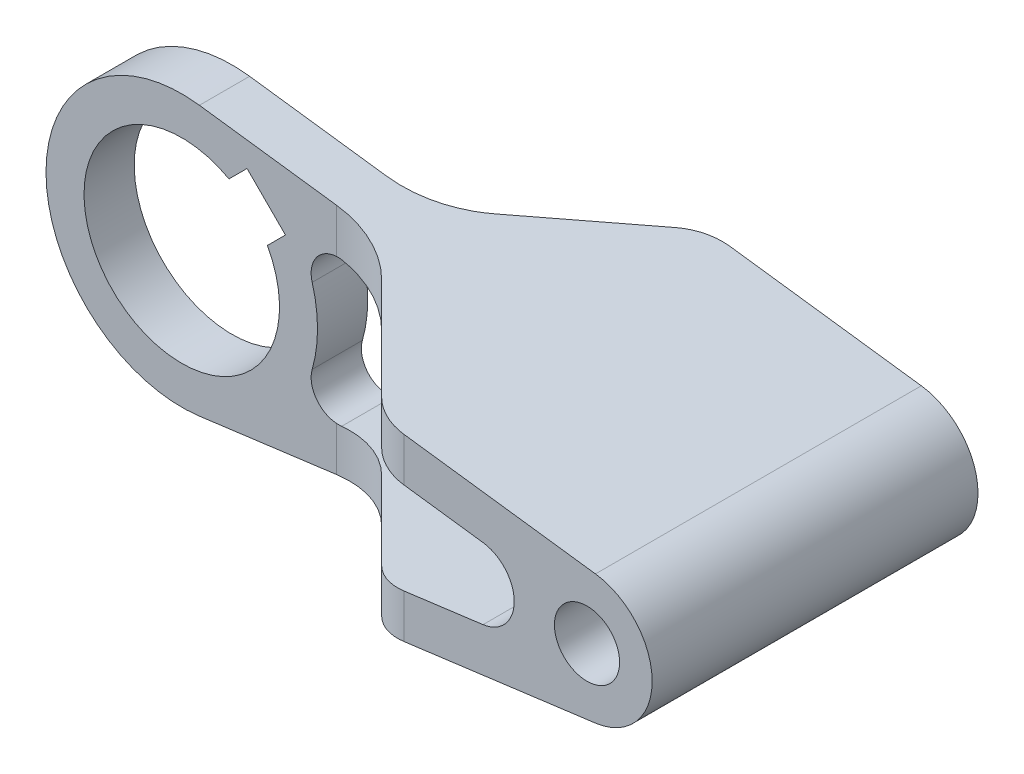
from build123d import *

# Parameters (mm, degrees)
SKETCH1_R           = 12
SKETCH1_R_2         = 6
BOSS_EXTRUDE1_DEPTH = 30
CUT_EXTRUDE1_DEPTH  = 30
FILLET1_R           = 10


with BuildPart() as part:
    # Sketch1 → Boss-Extrude1 (new, symmetric)
    # profile 1 of 2: a face of its own
    with BuildSketch(Plane.XY):
        with BuildLine():
            Line((44.05305559, 11.898167926), (-54.25694441, 24.787849846))
            ThreePointArc((-54.25694441, 24.787849846), (-82.50694441, 0), (-54.25694441, -24.787849846))
            Line((-54.25694441, -24.787849846), (44.05305559, -11.898167926))
            ThreePointArc((44.05305559, -11.898167926), (30.49305559, 0), (44.05305559, 11.898167926))
        make_face()
        with BuildLine():
            ThreePointArc((-33.488504763, 6.936465737), (-32.476597793, 11.582960804), (-28.034816833, 13.281328853))
            Line((-28.034816833, 13.281328853), (23.35105559, 6.543992359))
            ThreePointArc((23.35105559, 6.543992359), (29.09305559, 0), (23.35105559, -6.543992359))
            Line((23.35105559, -6.543992359), (-28.034816833, -13.281328853))
            ThreePointArc((-28.034816833, -13.281328853), (-32.476597793, -11.582960804), (-33.488504763, -6.936465737))
            ThreePointArc((-33.488504763, -6.936465737), (-32.50694441, 0), (-33.488504763, 6.936465737))
        make_face(mode=Mode.SUBTRACT)
        with BuildLine():
            ThreePointArc((-41.744391243, 8.691485355), (-70.234866471, -12.727922061), (-48.815459055, 15.762553167))
            Line((-48.815459055, 15.762553167), (-45.48612913, 19.091883092))
            Line((-45.48612913, 19.091883092), (-38.415061318, 12.02081528))
            Line((-38.415061318, 12.02081528), (-41.744391243, 8.691485355))
        make_face(mode=Mode.SUBTRACT)
    # profile 2 of 2: a face of its own
    with BuildSketch(Plane.XY):
        with Locations((42.49305559, 0)):
            Circle(SKETCH1_R)
        with Locations((42.49305559, 0)):
            Circle(SKETCH1_R_2, mode=Mode.SUBTRACT)
    extrude(amount=BOSS_EXTRUDE1_DEPTH, both=True)

    # Sketch5 → Cut-Extrude1 (cut, symmetric)
    with BuildSketch(Plane(origin=(0, 0, 0), x_dir=(1, 0, 0), z_dir=(0, 1, 0))):
        with BuildLine():
            ThreePointArc((-14.84129936, 10.479353549), (-21.329766336, 6.143898522), (-28.983434984, 4.621489173))
            Line((-28.983434984, 4.621489173), (-82.50694441, 4.621489173))
            Line((-82.50694441, 4.621489173), (-82.50694441, 30))
            Line((-82.50694441, 30), (4.679347091, 30))
            Line((4.679347091, 30), (-14.84129936, 10.479353549))
        make_face()
        with BuildLine():
            ThreePointArc((-28.983434984, -4.621489173), (-21.329766336, -6.143898522), (-14.84129936, -10.479353549))
            Line((-14.84129936, -10.479353549), (4.679347091, -30))
            Line((4.679347091, -30), (-82.50694441, -30))
            Line((-82.50694441, -30), (-82.50694441, -4.621489173))
            Line((-82.50694441, -4.621489173), (-28.983434984, -4.621489173))
        make_face()
    extrude(amount=CUT_EXTRUDE1_DEPTH, both=True, mode=Mode.SUBTRACT)

    # Fillet1
    fillet1_edges = [part.edges().sort_by_distance(p)[0] for p in [
        (4.679347091, 13.026323567, -30),
        (4.679347091, -13.026323567, -30),
        (4.679347091, -13.026323567, 30),
        (4.679347091, 13.026323567, 30),
    ]]
    fillet(fillet1_edges, radius=FILLET1_R)


solid = part.part
